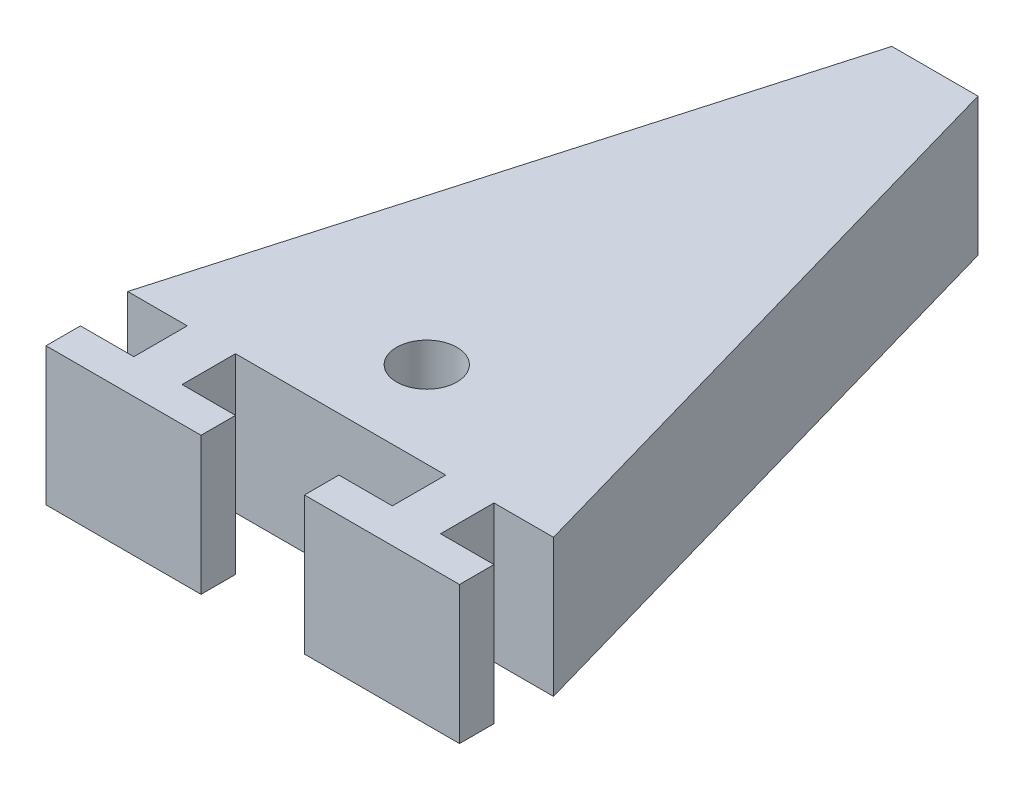
from build123d import *

# Parameters (mm, degrees)
BOSS_EXTRUDE1_DEPTH     = 8
BOSS_EXTRU_1_DEPTH      = 8
ESQUISSE3_W             = 12.203333334
ESQUISSE3_H             = 0.5
ENL_V_MAT_EXTRU_1_DEPTH = 39.016443811
SKETCH3_R               = 1.75
CUT_EXTRUDE1_DEPTH      = 38.969711345


with BuildPart() as part:
    # Sketch2 → Boss-Extrude1 (new body)
    with BuildSketch(Plane(origin=(0, 0, 0), x_dir=(1, 0, 0), z_dir=(0, 1, 0))):
        Polygon((12.5, 0), (2.5, 35), (-2.5, 35), (-12.5, 0), align=None)
    extrude(amount=BOSS_EXTRUDE1_DEPTH)

    # Esquisse2 → Boss.-Extru.1 (add)
    with BuildSketch(Plane(origin=(0, 0, 0), x_dir=(1, 0, 0), z_dir=(0, 1, 0))):
        Polygon((-8.901666667, 0), (-8.901666667, -2.6), (-12.001666667, -2.6), (-12.001666667, -4.6), (-3.001666667, -4.6), (-3.001666667, -2.6), (-6.101666667, -2.6), (-6.101666667, 0), align=None)
    boss_extru_1 = extrude(amount=BOSS_EXTRU_1_DEPTH)

    # Symétrie1: Boss.-Extru.1 across plane
    add(boss_extru_1.mirror(Plane(origin=(0, 0, 0), x_dir=(0, 0, 1), z_dir=(1, 0, 0))))

    # Esquisse3 → Enlèv. mat.-Extru.1 (cut, through all)
    with BuildSketch(Plane(origin=(0, 8, 0), x_dir=(1, 0, 0), z_dir=(0, 1, 0))):
        Polygon((-12.5, 0), (-8.901666667, 0), (-8.901666667, 0.5), (-12.357142857, 0.5), align=None)
        with Locations((0, 0.25)):
            Rectangle(ESQUISSE3_W, ESQUISSE3_H)
        Polygon((8.901666667, 0), (8.901666667, 0.5), (12.357142857, 0.5), (12.5, 0), align=None)
    extrude(amount=-ENL_V_MAT_EXTRU_1_DEPTH, mode=Mode.SUBTRACT)

    # Sketch3 → Cut-Extrude1 (cut, through all)
    with BuildSketch(Plane.XZ):
        with Locations(Location((0, -5.5, 0), (0, 0, 270))):
            Circle(SKETCH3_R)
    extrude(amount=-CUT_EXTRUDE1_DEPTH, mode=Mode.SUBTRACT)


solid = part.part
